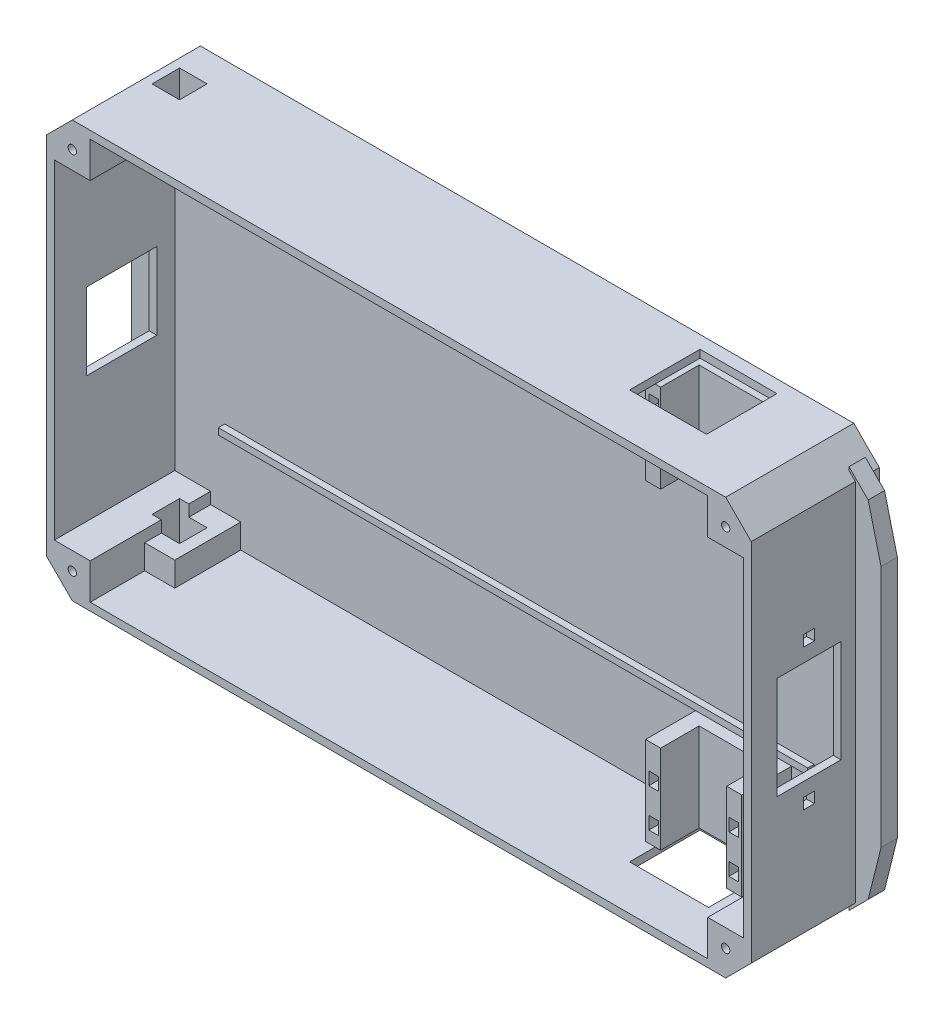
from build123d import *

# Parameters (mm, degrees)
FACETED_FLOOR_220X130_DEPTH             = 2.4
FACETED_HOLLOW_WALLS_2P4_START          = 2.4
FACETED_HOLLOW_WALLS_2P4_DEPTH          = 37.6
LID_POST_1_1_START                      = 2.4
SKETCH3_W                               = 11.2
SKETCH3_H                               = 11.2
LID_POST_1_1_DEPTH                      = 37.6
M3_PILOT_1_1_START                      = 27
SKETCH4_R                               = 1.3
M3_PILOT_1_1_DEPTH                      = 14
SKETCH5_W                               = 11.2
SKETCH5_H                               = 11.2
LID_POST_1_1_2_DEPTH                    = 37.6
SKETCH6_R                               = 1.3
M3_PILOT_1_1_2_DEPTH                    = 14
SKETCH7_W                               = 11.2
SKETCH7_H                               = 11.2
LID_POST_1_1_3_DEPTH                    = 37.6
SKETCH8_R                               = 1.3
M3_PILOT_1_1_3_DEPTH                    = 14
SKETCH9_W                               = 11.2
SKETCH9_H                               = 11.2
LID_POST_1_1_4_DEPTH                    = 37.6
SKETCH10_R                              = 1.3
M3_PILOT_1_1_4_DEPTH                    = 14
MOTOR_SADDLE_BASE_1_START               = 2.4
SKETCH11_W                              = 30
SKETCH11_H                              = 30
MOTOR_SADDLE_BASE_1_DEPTH               = 3.6
MOTOR_GUIDE_A_1_START                   = 6
SKETCH12_W                              = 4.7
SKETCH12_H                              = 30
MOTOR_GUIDE_A_1_DEPTH                   = 12
MOTOR_GUIDE_B_1_START                   = 6
SKETCH13_W                              = 4.7
SKETCH13_H                              = 30
MOTOR_GUIDE_B_1_DEPTH                   = 12
TIESLOT_1_56_43_START                   = -0.1
SKETCH14_W                              = 3
SKETCH14_H                              = 4
TIESLOT_1_56_43_DEPTH                   = 19
TIESLOT_1_81_43_START                   = -0.1
SKETCH15_W                              = 3
SKETCH15_H                              = 4
TIESLOT_1_81_43_DEPTH                   = 19
TIESLOT_1_56_55_START                   = -0.1
SKETCH16_W                              = 3
SKETCH16_H                              = 4
TIESLOT_1_56_55_DEPTH                   = 19
TIESLOT_1_81_55_START                   = -0.1
SKETCH17_W                              = 3
SKETCH17_H                              = 4
TIESLOT_1_81_55_DEPTH                   = 19
MOTOR_SIDE_WINDOW_1_START               = 4
SKETCH18_W                              = 24.65
SKETCH18_H                              = 3.4
MOTOR_SIDE_WINDOW_1_DEPTH               = 22
REAR_AXLE_SUPPORT_1_START               = 2.4
SKETCH19_W                              = 16
SKETCH19_H                              = 10
REAR_AXLE_SUPPORT_1_DEPTH               = 20.6
REAR_PRINTED_AXLE_CLEARANCE_8P6_1_START = 9.2
SKETCH20_W                              = 8.6
SKETCH20_H                              = 15
REAR_PRINTED_AXLE_CLEARANCE_8P6_1_DEPTH = 8.6
SKETCH21_W                              = 30
SKETCH21_H                              = 30
MOTOR_SADDLE_BASE_1_2_DEPTH             = 3.6
SKETCH22_W                              = 4.7
SKETCH22_H                              = 30
MOTOR_GUIDE_A_1_2_DEPTH                 = 12
SKETCH23_W                              = 4.7
SKETCH23_H                              = 30
MOTOR_GUIDE_B_1_2_DEPTH                 = 12
SKETCH24_W                              = 3
SKETCH24_H                              = 4
TIESLOT_1_56_43_2_DEPTH                 = 19
SKETCH25_W                              = 3
SKETCH25_H                              = 4
TIESLOT_1_81_43_2_DEPTH                 = 19
SKETCH26_W                              = 3
SKETCH26_H                              = 4
TIESLOT_1_56_55_2_DEPTH                 = 19
SKETCH27_W                              = 3
SKETCH27_H                              = 4
TIESLOT_1_81_55_2_DEPTH                 = 19
SKETCH28_W                              = 24
SKETCH28_H                              = 3.4
MOTOR_SIDE_WINDOW_1_2_DEPTH             = 22
SKETCH29_W                              = 16
SKETCH29_H                              = 10
REAR_AXLE_SUPPORT_1_2_DEPTH             = 20.6
REAR_PRINTED_AXLE_CLEARANCE_8P61_START  = 9.2
SKETCH30_W                              = 8.6
SKETCH30_H                              = 14.6
REAR_PRINTED_AXLE_CLEARANCE_8P61_DEPTH  = 8.6
REAR_USB_ACCESS_24X22_START             = 8
SKETCH31_W                              = 3.4
SKETCH31_H                              = 24
REAR_USB_ACCESS_24X22_DEPTH             = 22
FRONT_TOF_WINDOW_32X20_START            = 12
SKETCH32_W                              = 3.4
SKETCH32_H                              = 32
FRONT_TOF_WINDOW_32X20_DEPTH            = 20
TOF_M3_CLEARANCE_1_START                = 20.3
SKETCH33_W                              = 3.4
SKETCH33_H                              = 3.4
TOF_M3_CLEARANCE_1_DEPTH                = 3.4
SKETCH34_W                              = 3.4
SKETCH34_H                              = 3.4
TOF_M3_CLEARANCE_1_2_DEPTH              = 3.4
BREADBOARD_LEFT_GUIDE_START             = 2.4
SKETCH35_W                              = 184
SKETCH35_H                              = 2
BREADBOARD_LEFT_GUIDE_DEPTH             = 2
BREADBOARD_RIGHT_GUIDE_START            = 2.4
SKETCH36_W                              = 184
SKETCH36_H                              = 2
BREADBOARD_RIGHT_GUIDE_DEPTH            = 2
OUTER_CORNER_TRIM_1_1_START             = 0.1
OUTER_CORNER_TRIM_1_1_DEPTH             = 40.2
OUTER_CORNER_TRIM_1_1_2_DEPTH           = 40.2
OUTER_CORNER_TRIM_1_1_3_DEPTH           = 40.2
OUTER_CORNER_TRIM_1_1_4_DEPTH           = 40.2
ANGLED_FRONT_BUMPER_START               = 2.4
ANGLED_FRONT_BUMPER_DEPTH               = 5.1
ANGLED_REAR_BUMPER_START                = 2.4
ANGLED_REAR_BUMPER_DEPTH                = 5.1


with BuildPart() as part:
    # Sketch1 → Faceted_Floor_220x130 (new body)
    with BuildSketch(Plane.XY):
        Polygon((-102, -65), (102, -65), (110, -57), (110, 57), (102, 65), (-102, 65), (-110, 57), (-110, -57), align=None)
    extrude(amount=FACETED_FLOOR_220X130_DEPTH)

    # Sketch2 → Faceted_Hollow_Walls_2p4 (add)
    with BuildSketch(Plane.XY.offset(FACETED_HOLLOW_WALLS_2P4_START)):
        Polygon((-102, -65), (102, -65), (110, -57), (110, 57), (102, 65), (-102, 65), (-110, 57), (-110, -57), align=None)
        Polygon((-102, -62.6), (102, -62.6), (107.6, -57), (107.6, 57), (102, 62.6), (-102, 62.6), (-107.6, 57), (-107.6, -57), align=None, mode=Mode.SUBTRACT)
    extrude(amount=FACETED_HOLLOW_WALLS_2P4_DEPTH)

    # Sketch3 → Lid_Post_-1_-1 (add)
    with BuildSketch(Plane.XY.offset(LID_POST_1_1_START)):
        with Locations((-102, -57)):
            Rectangle(SKETCH3_W, SKETCH3_H)
    extrude(amount=LID_POST_1_1_DEPTH)

    # Sketch4 → M3_Pilot_-1_-1 (cut)
    with BuildSketch(Plane.XY.offset(M3_PILOT_1_1_START)):
        with Locations((-102, -57)):
            Circle(SKETCH4_R)
    extrude(amount=M3_PILOT_1_1_DEPTH, mode=Mode.SUBTRACT)

    # Sketch5 → Lid_Post_-1_1 2 (add)
    with BuildSketch(Plane.XY.offset(LID_POST_1_1_START)):
        with Locations((-102, 57)):
            Rectangle(SKETCH5_W, SKETCH5_H)
    extrude(amount=LID_POST_1_1_2_DEPTH)

    # Sketch6 → M3_Pilot_-1_1 2 (cut)
    with BuildSketch(Plane.XY.offset(M3_PILOT_1_1_START)):
        with Locations((-102, 57)):
            Circle(SKETCH6_R)
    extrude(amount=M3_PILOT_1_1_2_DEPTH, mode=Mode.SUBTRACT)

    # Sketch7 → Lid_Post_1_-1 3 (add)
    with BuildSketch(Plane.XY.offset(LID_POST_1_1_START)):
        with Locations((102, -57)):
            Rectangle(SKETCH7_W, SKETCH7_H)
    extrude(amount=LID_POST_1_1_3_DEPTH)

    # Sketch8 → M3_Pilot_1_-1 3 (cut)
    with BuildSketch(Plane.XY.offset(M3_PILOT_1_1_START)):
        with Locations((102, -57)):
            Circle(SKETCH8_R)
    extrude(amount=M3_PILOT_1_1_3_DEPTH, mode=Mode.SUBTRACT)

    # Sketch9 → Lid_Post_1_1 4 (add)
    with BuildSketch(Plane.XY.offset(LID_POST_1_1_START)):
        with Locations((102, 57)):
            Rectangle(SKETCH9_W, SKETCH9_H)
    extrude(amount=LID_POST_1_1_4_DEPTH)

    # Sketch10 → M3_Pilot_1_1 4 (cut)
    with BuildSketch(Plane.XY.offset(M3_PILOT_1_1_START)):
        with Locations((102, 57)):
            Circle(SKETCH10_R)
    extrude(amount=M3_PILOT_1_1_4_DEPTH, mode=Mode.SUBTRACT)

    # Sketch11 → Motor_Saddle_Base_-1 (add)
    with BuildSketch(Plane.XY.offset(MOTOR_SADDLE_BASE_1_START)):
        with Locations((70, -50)):
            Rectangle(SKETCH11_W, SKETCH11_H)
    extrude(amount=MOTOR_SADDLE_BASE_1_DEPTH)

    # Sketch12 → Motor_Guide_A_-1 (add)
    with BuildSketch(Plane.XY.offset(MOTOR_GUIDE_A_1_START)):
        with Locations((57.35, -50)):
            Rectangle(SKETCH12_W, SKETCH12_H)
    extrude(amount=MOTOR_GUIDE_A_1_DEPTH)

    # Sketch13 → Motor_Guide_B_-1 (add)
    with BuildSketch(Plane.XY.offset(MOTOR_GUIDE_B_1_START)):
        with Locations((82.65, -50)):
            Rectangle(SKETCH13_W, SKETCH13_H)
    extrude(amount=MOTOR_GUIDE_B_1_DEPTH)

    # Sketch14 → TieSlot_-1_56_43 (cut)
    with BuildSketch(Plane.XY.offset(TIESLOT_1_56_43_START)):
        with Locations((57.5, -45)):
            Rectangle(SKETCH14_W, SKETCH14_H)
    extrude(amount=TIESLOT_1_56_43_DEPTH, mode=Mode.SUBTRACT)

    # Sketch15 → TieSlot_-1_81_43 (cut)
    with BuildSketch(Plane.XY.offset(TIESLOT_1_81_43_START)):
        with Locations((82.5, -45)):
            Rectangle(SKETCH15_W, SKETCH15_H)
    extrude(amount=TIESLOT_1_81_43_DEPTH, mode=Mode.SUBTRACT)

    # Sketch16 → TieSlot_-1_56_55 (cut)
    with BuildSketch(Plane.XY.offset(TIESLOT_1_56_55_START)):
        with Locations((57.5, -57)):
            Rectangle(SKETCH16_W, SKETCH16_H)
    extrude(amount=TIESLOT_1_56_55_DEPTH, mode=Mode.SUBTRACT)

    # Sketch17 → TieSlot_-1_81_55 (cut)
    with BuildSketch(Plane.XY.offset(TIESLOT_1_81_55_START)):
        with Locations((82.5, -57)):
            Rectangle(SKETCH17_W, SKETCH17_H)
    extrude(amount=TIESLOT_1_81_55_DEPTH, mode=Mode.SUBTRACT)

    # Sketch18 → Motor_Side_Window_-1 (cut)
    with BuildSketch(Plane.XY.offset(MOTOR_SIDE_WINDOW_1_START)):
        with Locations((70.325, -64.3)):
            Rectangle(SKETCH18_W, SKETCH18_H)
    extrude(amount=MOTOR_SIDE_WINDOW_1_DEPTH, mode=Mode.SUBTRACT)

    # Sketch19 → Rear_Axle_Support_-1 (add)
    with BuildSketch(Plane.XY.offset(REAR_AXLE_SUPPORT_1_START)):
        with Locations((-95, -60)):
            Rectangle(SKETCH19_W, SKETCH19_H)
    extrude(amount=REAR_AXLE_SUPPORT_1_DEPTH)

    # Sketch20 → Rear_Printed_Axle_Clearance_8p6-1 (cut)
    with BuildSketch(Plane.XY.offset(REAR_PRINTED_AXLE_CLEARANCE_8P6_1_START)):
        with Locations((-95, -58.5)):
            Rectangle(SKETCH20_W, SKETCH20_H)
    extrude(amount=REAR_PRINTED_AXLE_CLEARANCE_8P6_1_DEPTH, mode=Mode.SUBTRACT)

    # Sketch21 → Motor_Saddle_Base_1 2 (add)
    with BuildSketch(Plane.XY.offset(MOTOR_SADDLE_BASE_1_START)):
        with Locations((70, 50)):
            Rectangle(SKETCH21_W, SKETCH21_H)
    extrude(amount=MOTOR_SADDLE_BASE_1_2_DEPTH)

    # Sketch22 → Motor_Guide_A_1 2 (add)
    with BuildSketch(Plane.XY.offset(MOTOR_GUIDE_A_1_START)):
        with Locations((57.35, 50)):
            Rectangle(SKETCH22_W, SKETCH22_H)
    extrude(amount=MOTOR_GUIDE_A_1_2_DEPTH)

    # Sketch23 → Motor_Guide_B_1 2 (add)
    with BuildSketch(Plane.XY.offset(MOTOR_GUIDE_B_1_START)):
        with Locations((82.65, 50)):
            Rectangle(SKETCH23_W, SKETCH23_H)
    extrude(amount=MOTOR_GUIDE_B_1_2_DEPTH)

    # Sketch24 → TieSlot_1_56_43 2 (cut)
    with BuildSketch(Plane.XY.offset(TIESLOT_1_56_43_START)):
        with Locations((57.5, 45)):
            Rectangle(SKETCH24_W, SKETCH24_H)
    extrude(amount=TIESLOT_1_56_43_2_DEPTH, mode=Mode.SUBTRACT)

    # Sketch25 → TieSlot_1_81_43 2 (cut)
    with BuildSketch(Plane.XY.offset(TIESLOT_1_81_43_START)):
        with Locations((82.5, 45)):
            Rectangle(SKETCH25_W, SKETCH25_H)
    extrude(amount=TIESLOT_1_81_43_2_DEPTH, mode=Mode.SUBTRACT)

    # Sketch26 → TieSlot_1_56_55 2 (cut)
    with BuildSketch(Plane.XY.offset(TIESLOT_1_56_55_START)):
        with Locations((57.5, 57)):
            Rectangle(SKETCH26_W, SKETCH26_H)
    extrude(amount=TIESLOT_1_56_55_2_DEPTH, mode=Mode.SUBTRACT)

    # Sketch27 → TieSlot_1_81_55 2 (cut)
    with BuildSketch(Plane.XY.offset(TIESLOT_1_81_55_START)):
        with Locations((82.5, 57)):
            Rectangle(SKETCH27_W, SKETCH27_H)
    extrude(amount=TIESLOT_1_81_55_2_DEPTH, mode=Mode.SUBTRACT)

    # Sketch28 → Motor_Side_Window_1 2 (cut)
    with BuildSketch(Plane.XY.offset(MOTOR_SIDE_WINDOW_1_START)):
        with Locations((70, 64.3)):
            Rectangle(SKETCH28_W, SKETCH28_H)
    extrude(amount=MOTOR_SIDE_WINDOW_1_2_DEPTH, mode=Mode.SUBTRACT)

    # Sketch29 → Rear_Axle_Support_1 2 (add)
    with BuildSketch(Plane.XY.offset(REAR_AXLE_SUPPORT_1_START)):
        with Locations((-95, 60)):
            Rectangle(SKETCH29_W, SKETCH29_H)
    extrude(amount=REAR_AXLE_SUPPORT_1_2_DEPTH)

    # Sketch30 → Rear_Printed_Axle_Clearance_8p61 (cut)
    with BuildSketch(Plane.XY.offset(REAR_PRINTED_AXLE_CLEARANCE_8P61_START)):
        with Locations((-95, 58.7)):
            Rectangle(SKETCH30_W, SKETCH30_H)
    extrude(amount=REAR_PRINTED_AXLE_CLEARANCE_8P61_DEPTH, mode=Mode.SUBTRACT)

    # Sketch31 → Rear_USB_Access_24x22 (cut)
    with BuildSketch(Plane.XY.offset(REAR_USB_ACCESS_24X22_START)):
        with Locations((-109.3, 0)):
            Rectangle(SKETCH31_W, SKETCH31_H)
    extrude(amount=REAR_USB_ACCESS_24X22_DEPTH, mode=Mode.SUBTRACT)

    # Sketch32 → Front_ToF_Window_32x20 (cut)
    with BuildSketch(Plane.XY.offset(FRONT_TOF_WINDOW_32X20_START)):
        with Locations((109.3, 0)):
            Rectangle(SKETCH32_W, SKETCH32_H)
    extrude(amount=FRONT_TOF_WINDOW_32X20_DEPTH, mode=Mode.SUBTRACT)

    # Sketch33 → ToF_M3_Clearance_-1 (cut)
    with BuildSketch(Plane.XY.offset(TOF_M3_CLEARANCE_1_START)):
        with Locations((109.3, -22)):
            Rectangle(SKETCH33_W, SKETCH33_H)
    extrude(amount=TOF_M3_CLEARANCE_1_DEPTH, mode=Mode.SUBTRACT)

    # Sketch34 → ToF_M3_Clearance_1 2 (cut)
    with BuildSketch(Plane.XY.offset(TOF_M3_CLEARANCE_1_START)):
        with Locations((109.3, 22)):
            Rectangle(SKETCH34_W, SKETCH34_H)
    extrude(amount=TOF_M3_CLEARANCE_1_2_DEPTH, mode=Mode.SUBTRACT)

    # Sketch35 → Breadboard_Left_Guide (add)
    with BuildSketch(Plane.XY.offset(BREADBOARD_LEFT_GUIDE_START)):
        with Locations((0, -32)):
            Rectangle(SKETCH35_W, SKETCH35_H)
    extrude(amount=BREADBOARD_LEFT_GUIDE_DEPTH)

    # Sketch36 → Breadboard_Right_Guide (add)
    with BuildSketch(Plane.XY.offset(BREADBOARD_RIGHT_GUIDE_START)):
        with Locations((0, 32)):
            Rectangle(SKETCH36_W, SKETCH36_H)
    extrude(amount=BREADBOARD_RIGHT_GUIDE_DEPTH)

    # Sketch37 → Outer_Corner_Trim_-1_-1 (cut)
    with BuildSketch(Plane.XY.offset(OUTER_CORNER_TRIM_1_1_START)):
        Polygon((-102, -65), (-110, -57), (-110, -65), align=None)
    extrude(amount=OUTER_CORNER_TRIM_1_1_DEPTH, mode=Mode.SUBTRACT)

    # Sketch38 → Outer_Corner_Trim_-1_1 2 (cut)
    with BuildSketch(Plane.XY.offset(OUTER_CORNER_TRIM_1_1_START)):
        Polygon((-102, 65), (-110, 57), (-110, 65), align=None)
    extrude(amount=OUTER_CORNER_TRIM_1_1_2_DEPTH, mode=Mode.SUBTRACT)

    # Sketch39 → Outer_Corner_Trim_1_-1 3 (cut)
    with BuildSketch(Plane.XY.offset(OUTER_CORNER_TRIM_1_1_START)):
        Polygon((102, -65), (110, -57), (110, -65), align=None)
    extrude(amount=OUTER_CORNER_TRIM_1_1_3_DEPTH, mode=Mode.SUBTRACT)

    # Sketch40 → Outer_Corner_Trim_1_1 4 (cut)
    with BuildSketch(Plane.XY.offset(OUTER_CORNER_TRIM_1_1_START)):
        Polygon((102, 65), (110, 57), (110, 65), align=None)
    extrude(amount=OUTER_CORNER_TRIM_1_1_4_DEPTH, mode=Mode.SUBTRACT)

    # Sketch41 → Angled_Front_Bumper (add)
    with BuildSketch(Plane.XY.offset(ANGLED_FRONT_BUMPER_START)):
        Polygon((108, -60), (114, -54), (118, -38), (118, 38), (114, 54), (108, 60), align=None)
    extrude(amount=ANGLED_FRONT_BUMPER_DEPTH)

    # Sketch42 → Angled_Rear_Bumper (add)
    with BuildSketch(Plane.XY.offset(ANGLED_REAR_BUMPER_START)):
        Polygon((-107.6, -45), (-112, -45), (-116, -39), (-116, 39), (-112, 45), (-107.6, 45), align=None)
    extrude(amount=ANGLED_REAR_BUMPER_DEPTH)


solid = part.part
